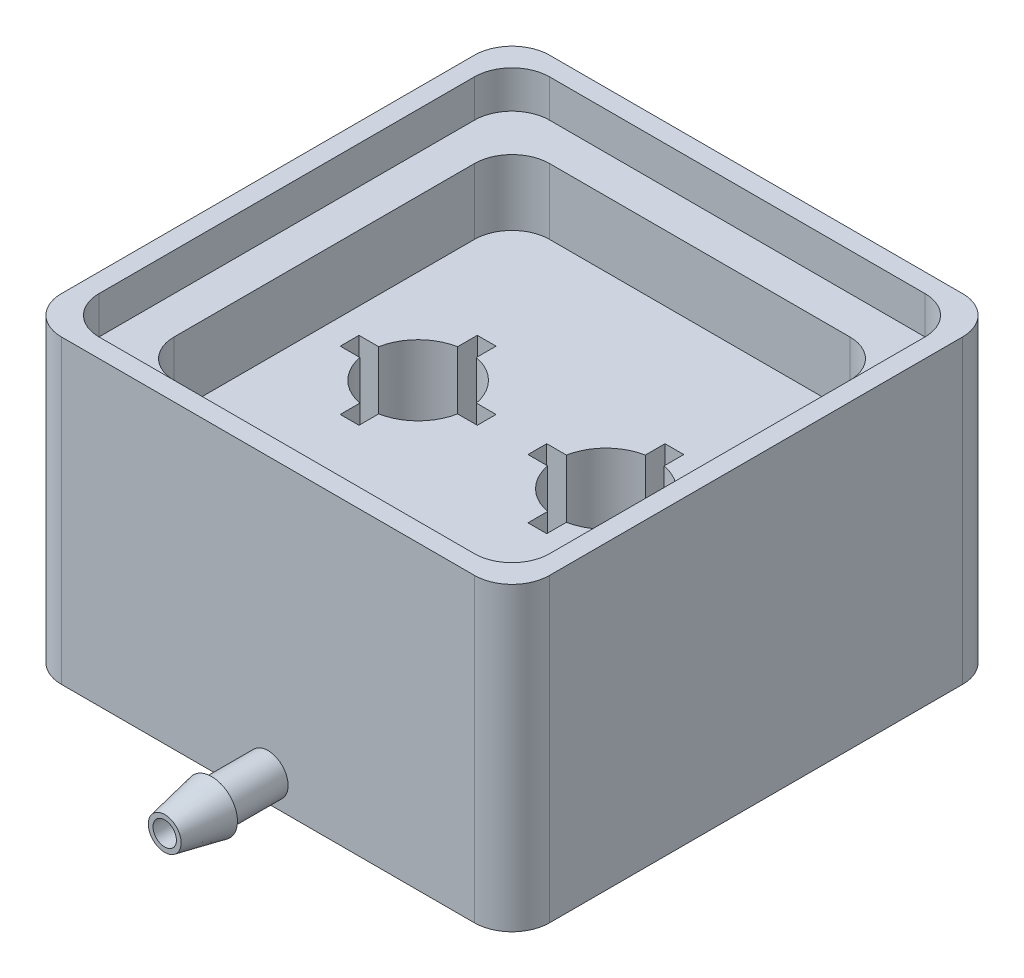
from build123d import *

# Parameters (mm, degrees)
SKETCH1_R                      = 2.65
BOSS_EXTRUDE1_DEPTH            = 10.53
CUT_EXTRUDE1_START             = -9.785
CUT_EXTRUDE1_DEPTH             = 9.785
CUT_EXTRUDE3_REACH             = 26.943
SKETCH10_R                     = 0.625
CUT_EXTRUDE3_DIRECTION_2_REACH = 26.943
CUT_EXTRUDE2_REACH             = 32.917
SKETCH5_R                      = 0.625
BOSS_EXTRUDE2_DEPTH            = 3.5
BOSS_EXTRUDE3_DEPTH            = 2


with BuildPart() as part:
    # Sketch1 → Boss-Extrude1 (new body)
    with BuildSketch(Plane(origin=(0, 0, 0), x_dir=(1, 0, 0), z_dir=(0, 1, 0))):
        with BuildLine():
            Line((-11, -13), (11, -13))
            ThreePointArc((11, -13), (12.414213562, -12.414213562), (13, -11))
            Line((13, -11), (13, 11))
            ThreePointArc((13, 11), (12.414213562, 12.414213562), (11, 13))
            Line((11, 13), (-11, 13))
            ThreePointArc((-11, 13), (-12.414213562, 12.414213562), (-13, 11))
            Line((-13, 11), (-13, -11))
            ThreePointArc((-13, -11), (-12.414213562, -12.414213562), (-11, -13))
        make_face()
        with Locations(Location((5, 0, 0), (0, 0, 270))):
            Circle(SKETCH1_R, mode=Mode.SUBTRACT)
        with Locations(Location((-5, 0, 0), (0, 0, 270))):
            Circle(SKETCH1_R, mode=Mode.SUBTRACT)
    extrude(amount=BOSS_EXTRUDE1_DEPTH)

    # Sketch2 → Cut-Extrude1 (cut)
    with BuildSketch(Plane(origin=(0, 10.53, 0), x_dir=(1, 0, 0), z_dir=(0, 1, 0)).offset(CUT_EXTRUDE1_START)):
        with BuildLine():
            Line((4.5, 3.65), (4.5, 2.602402736))
            ThreePointArc((4.5, 2.602402736), (5, 2.65), (5.5, 2.602402736))
            Line((5.5, 2.602402736), (5.5, 3.65))
            Line((5.5, 3.65), (4.5, 3.65))
        make_face()
        with BuildLine():
            ThreePointArc((7.65, 0), (7.638073848, -0.251130195), (7.602402736, -0.5))
            Line((7.602402736, -0.5), (8.65, -0.5))
            Line((8.65, -0.5), (8.65, 0.5))
            Line((8.65, 0.5), (7.602402736, 0.5))
            ThreePointArc((7.602402736, 0.5), (7.638073848, 0.251130195), (7.65, 0))
        make_face()
        with BuildLine():
            Line((4.5, -2.602402736), (4.5, -3.65))
            Line((4.5, -3.65), (5.5, -3.65))
            Line((5.5, -3.65), (5.5, -2.602402736))
            ThreePointArc((5.5, -2.602402736), (5, -2.65), (4.5, -2.602402736))
        make_face()
        with BuildLine():
            Line((1.35, -0.5), (2.397597264, -0.5))
            ThreePointArc((2.397597264, -0.5), (2.35, 0), (2.397597264, 0.5))
            Line((2.397597264, 0.5), (1.35, 0.5))
            Line((1.35, 0.5), (1.35, -0.5))
        make_face()
        with BuildLine():
            ThreePointArc((-2.35, 0), (-2.361926152, -0.251130195), (-2.397597264, -0.5))
            Line((-2.397597264, -0.5), (-1.35, -0.5))
            Line((-1.35, -0.5), (-1.35, 0.5))
            Line((-1.35, 0.5), (-2.397597264, 0.5))
            ThreePointArc((-2.397597264, 0.5), (-2.361926152, 0.251130195), (-2.35, 0))
        make_face()
        with BuildLine():
            Line((-5.5, 3.65), (-5.5, 2.602402736))
            ThreePointArc((-5.5, 2.602402736), (-5, 2.65), (-4.5, 2.602402736))
            Line((-4.5, 2.602402736), (-4.5, 3.65))
            Line((-4.5, 3.65), (-5.5, 3.65))
        make_face()
        with BuildLine():
            Line((-8.65, 0.5), (-8.65, -0.5))
            Line((-8.65, -0.5), (-7.602402736, -0.5))
            ThreePointArc((-7.602402736, -0.5), (-7.65, 0), (-7.602402736, 0.5))
            Line((-7.602402736, 0.5), (-8.65, 0.5))
        make_face()
        with BuildLine():
            ThreePointArc((-4.5, -2.602402736), (-5, -2.65), (-5.5, -2.602402736))
            Line((-5.5, -2.602402736), (-5.5, -3.65))
            Line((-5.5, -3.65), (-4.5, -3.65))
            Line((-4.5, -3.65), (-4.5, -2.602402736))
        make_face()
    extrude(amount=CUT_EXTRUDE1_DEPTH, mode=Mode.SUBTRACT)

    # Sketch3 → Revolve1 (revolve)
    with BuildSketch(Plane(origin=(0, 0, 0), x_dir=(0, 0, -1), z_dir=(1, 0, 0)), mode=Mode.PRIVATE) as revolve1_sk:
        Polygon((-13, 0.3), (-16, 0.3), (-16, 0), (-18.5, 0.5), (-18.5, 0.75), (-13, 0.75), align=None)
    revolve(revolve1_sk.sketch.rotate(Axis((0, 1.375, 13), (0, 0, 1)), 180), axis=Axis((0, 1.375, 13), (0, 0, 1)))

    # Sketch10 → Cut-Extrude3 (cut, up to next)
    with BuildSketch(Plane(origin=(0, 0, 0), x_dir=(0, 0, -1), z_dir=(1, 0, 0)), mode=Mode.PRIVATE) as cut_extrude3_sk1:
        with Locations(Location((0, 1.375, 0), (0, 0, 143.130102406))):
            Circle(SKETCH10_R)
    cut_extrude3_tool1 = extrude(cut_extrude3_sk1.sketch, amount=-CUT_EXTRUDE3_REACH, mode=Mode.PRIVATE) & part.part
    add(cut_extrude3_tool1.solids().sort_by_distance((0, 1.375, 0))[0], mode=Mode.SUBTRACT)

    # Sketch10 → Cut-Extrude3 direction 2 (cut, up to next)
    with BuildSketch(Plane(origin=(0, 0, 0), x_dir=(0, 0, -1), z_dir=(1, 0, 0)), mode=Mode.PRIVATE) as cut_extrude3_direction_2_sk1:
        with Locations(Location((0, 1.375, 0), (0, 0, 143.130102406))):
            Circle(SKETCH10_R)
    cut_extrude3_direction_2_tool1 = extrude(cut_extrude3_direction_2_sk1.sketch, amount=CUT_EXTRUDE3_DIRECTION_2_REACH, mode=Mode.PRIVATE) & part.part
    add(cut_extrude3_direction_2_tool1.solids().sort_by_distance((0, 1.375, 0))[0], mode=Mode.SUBTRACT)

    # Sketch5 → Cut-Extrude2 (cut, up to next)
    with BuildSketch(Plane.XY.offset(13), mode=Mode.PRIVATE) as cut_extrude2_sk1:
        with Locations(Location((0, 1.375, 0), (0, 0, 90))):
            Circle(SKETCH5_R)
    cut_extrude2_tool1 = extrude(cut_extrude2_sk1.sketch, amount=-CUT_EXTRUDE2_REACH, mode=Mode.PRIVATE) & part.part
    add(cut_extrude2_tool1.solids().sort_by_distance((0, 1.375, 13))[0], mode=Mode.SUBTRACT)

    # Sketch6 → Boss-Extrude2 (add)
    with BuildSketch(Plane(origin=(0, 10.53, 0), x_dir=(1, 0, 0), z_dir=(0, 1, 0))):
        with BuildLine():
            Line((-11, -13), (11, -13))
            ThreePointArc((11, -13), (12.414213562, -12.414213562), (13, -11))
            Line((13, -11), (13, 11))
            ThreePointArc((13, 11), (12.414213562, 12.414213562), (11, 13))
            Line((11, 13), (-11, 13))
            ThreePointArc((-11, 13), (-12.414213562, 12.414213562), (-13, 11))
            Line((-13, 11), (-13, -11))
            ThreePointArc((-13, -11), (-12.414213562, -12.414213562), (-11, -13))
        make_face()
        with BuildLine():
            Line((-8, -10), (8, -10))
            ThreePointArc((8, -10), (9.414213562, -9.414213562), (10, -8))
            Line((10, -8), (10, 8))
            ThreePointArc((10, 8), (9.414213562, 9.414213562), (8, 10))
            Line((8, 10), (-8, 10))
            ThreePointArc((-8, 10), (-9.414213562, 9.414213562), (-10, 8))
            Line((-10, 8), (-10, -8))
            ThreePointArc((-10, -8), (-9.414213562, -9.414213562), (-8, -10))
        make_face(mode=Mode.SUBTRACT)
    extrude(amount=BOSS_EXTRUDE2_DEPTH)

    # Sketch8 → Boss-Extrude3 (add)
    with BuildSketch(Plane(origin=(0, 14.03, 0), x_dir=(1, 0, 0), z_dir=(0, 1, 0))):
        with BuildLine():
            Line((-11, -13), (11, -13))
            ThreePointArc((11, -13), (12.414213562, -12.414213562), (13, -11))
            Line((13, -11), (13, 11))
            ThreePointArc((13, 11), (12.414213562, 12.414213562), (11, 13))
            Line((11, 13), (-11, 13))
            ThreePointArc((-11, 13), (-12.414213562, 12.414213562), (-13, 11))
            Line((-13, 11), (-13, -11))
            ThreePointArc((-13, -11), (-12.414213562, -12.414213562), (-11, -13))
        make_face()
        with BuildLine():
            Line((-10, -12), (10, -12))
            ThreePointArc((10, -12), (11.414213562, -11.414213562), (12, -10))
            Line((12, -10), (12, 10))
            ThreePointArc((12, 10), (11.414213562, 11.414213562), (10, 12))
            Line((10, 12), (-10, 12))
            ThreePointArc((-10, 12), (-11.414213562, 11.414213562), (-12, 10))
            Line((-12, 10), (-12, -10))
            ThreePointArc((-12, -10), (-11.414213562, -11.414213562), (-10, -12))
        make_face(mode=Mode.SUBTRACT)
    extrude(amount=BOSS_EXTRUDE3_DEPTH)


solid = part.part
